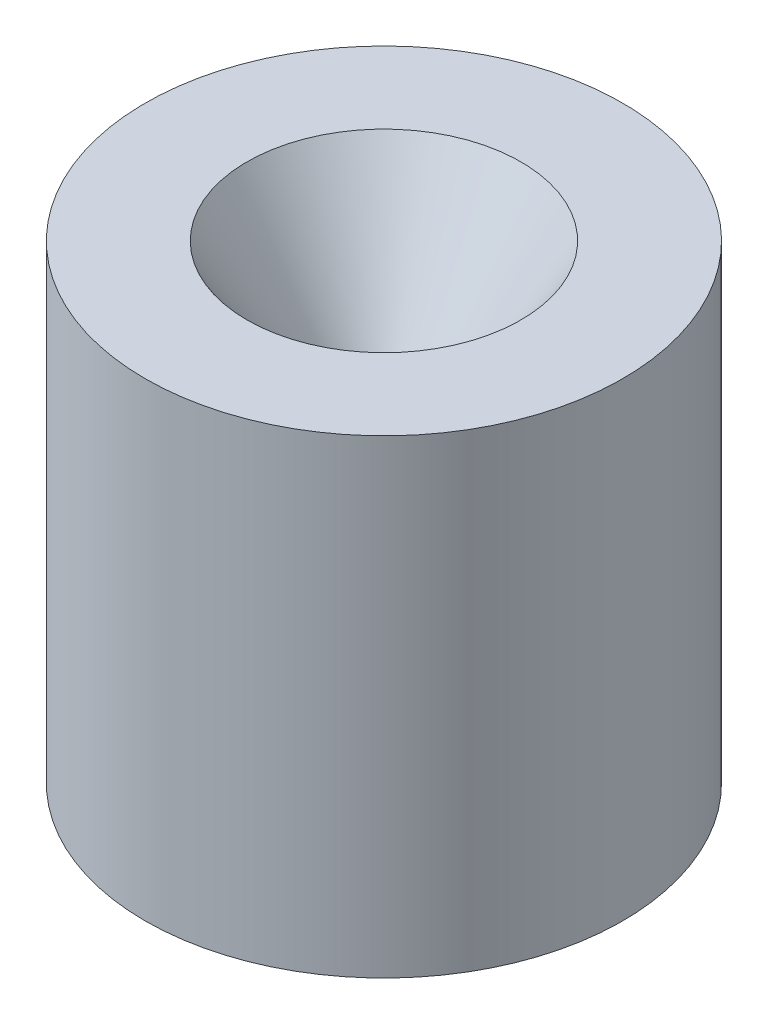
from build123d import *

# Parameters (mm, degrees)
SKETCH_1_R          = 61
EXTRUDE_1_DEPTH     = 120
SKETCH_2_R          = 35
CUT_EXTRUDE_1_DEPTH = 40
CUT_EXTRUDE_1_DRAFT = -32


with BuildPart() as part:
    # Эскиз1 → Бобышка-Вытянуть1 (new body)
    with BuildSketch(Plane(origin=(0, 0, 0), x_dir=(1, 0, 0), z_dir=(0, 1, 0))):
        with Locations(Location((0, 0, 0), (0, 0, 270))):
            Circle(SKETCH_1_R)
    extrude(amount=EXTRUDE_1_DEPTH)


with BuildPart() as cut_extrude_1_tool:
    # Эскиз2 → Вырез-Вытянуть1 (with draft: the straight prism first)
    with BuildSketch(Plane(origin=(0, 120, 0), x_dir=(1, 0, 0), z_dir=(0, 1, 0))):
        Circle(SKETCH_2_R)
    extrude(amount=-CUT_EXTRUDE_1_DEPTH)
    # Вырез-Вытянуть1: the draft: its side faces are tilted about the plane it starts from
    cut_extrude_1_sides = [cut_extrude_1_tool.faces().sort_by_distance(p)[0] for p in [
        (-35, 100, 0),
    ]]
    draft(cut_extrude_1_sides, Plane(origin=(0, 120, 0), x_dir=(1, 0, 0), z_dir=(0, 1, 0)), CUT_EXTRUDE_1_DRAFT)


with BuildPart() as part_1:
    add(part.part)

    # Вырез-Вытянуть1: cut by cut_extrude_1_tool
    add(cut_extrude_1_tool.part, mode=Mode.SUBTRACT)


solid = part_1.part
